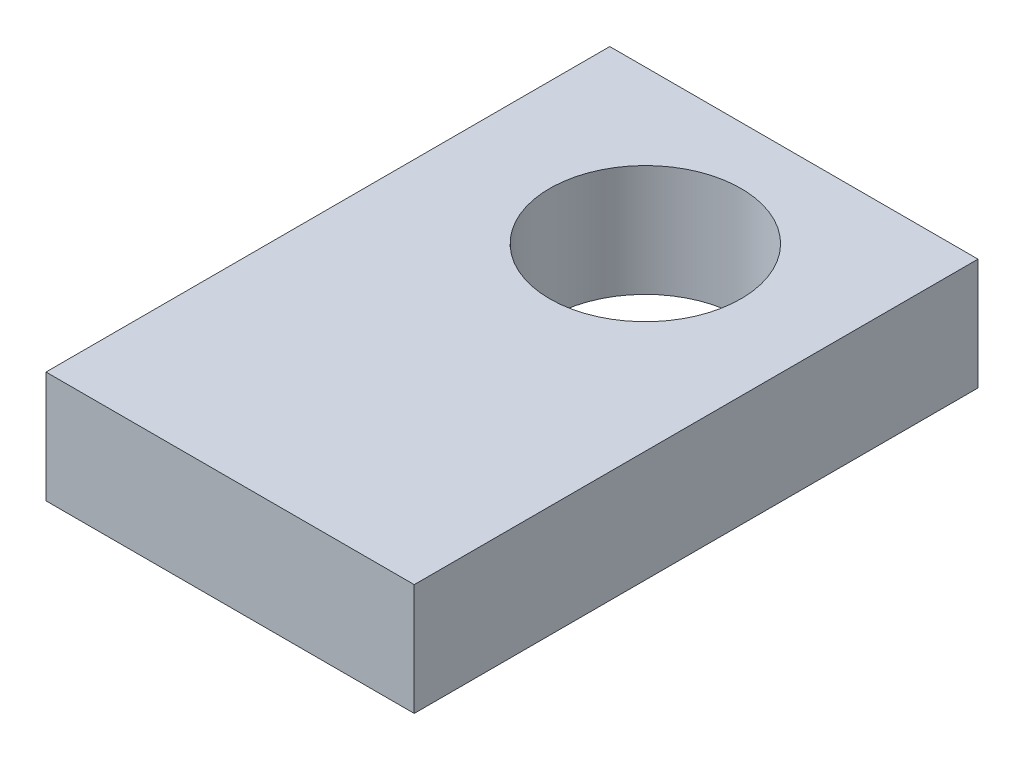
from build123d import *

# Parameters (mm, degrees)
IZIM1_W                     = 46.198257095
IZIM1_H                     = 70.728305111
Y_KSEKLIK_EKSTR_ZYON1_DEPTH = 14
IZIM2_R                     = 12
KES_EKSTR_ZYON1_DEPTH       = 15


with BuildPart() as part:
    # Çizim1 → Yükseklik-Ekstrüzyon1 (new body)
    with BuildSketch(Plane(origin=(0, 0, 0), x_dir=(1, 0, 0), z_dir=(0, 1, 0))):
        with Locations((2.453004802, 0.817668268)):
            Rectangle(IZIM1_W, IZIM1_H)
    extrude(amount=Y_KSEKLIK_EKSTR_ZYON1_DEPTH)

    # Çizim2 → Kes-Ekstrüzyon1 (cut)
    with BuildSketch(Plane(origin=(0, 0, 0), x_dir=(1, 0, 0), z_dir=(0, 1, 0))):
        with Locations(Location((3, 17, 0), (0, 0, 270))):
            Circle(IZIM2_R)
    extrude(amount=KES_EKSTR_ZYON1_DEPTH, mode=Mode.SUBTRACT)


solid = part.part
